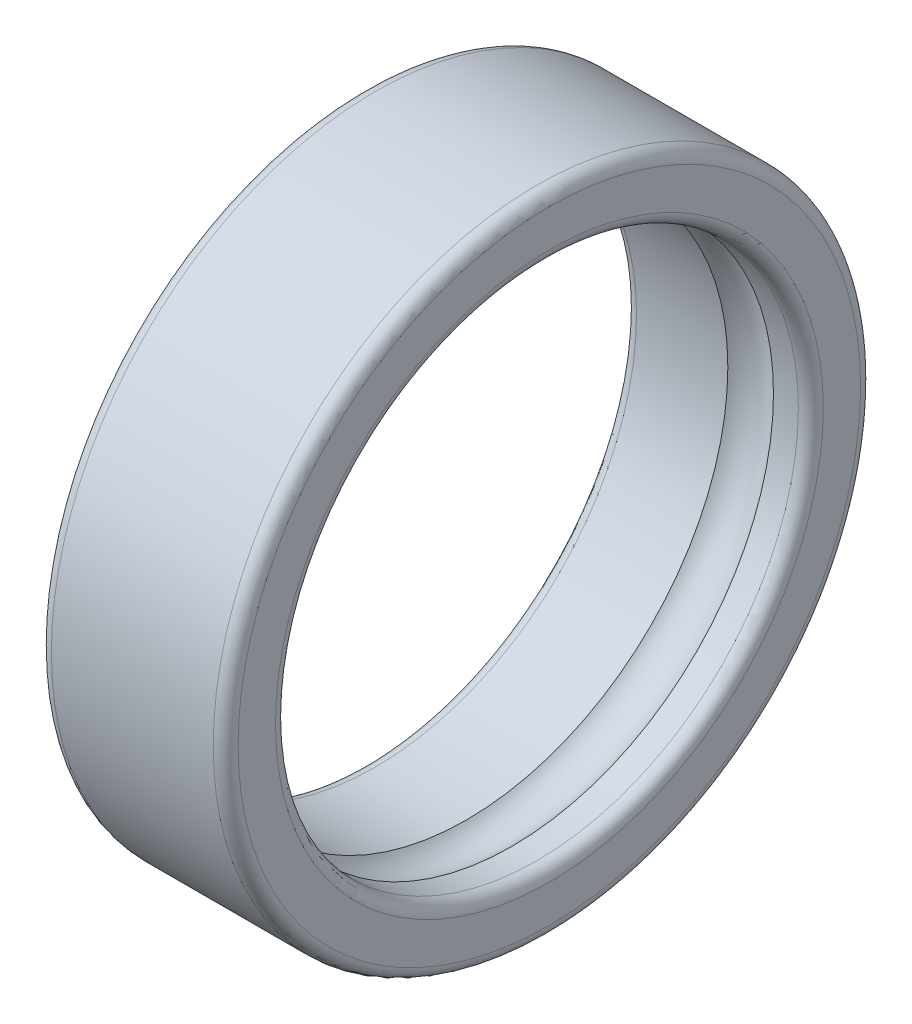
from build123d import *


with BuildPart() as part:
    # Sketch1 → Revolve1 (revolve)
    with BuildSketch(Plane.XY, mode=Mode.PRIVATE) as revolve1_sk:
        with BuildLine():
            Line((-7.5, 22), (-7.5, 25))
            ThreePointArc((-7.5, 25), (-7.207106781, 25.707106781), (-6.5, 26))
            Line((-6.5, 26), (6.5, 26))
            ThreePointArc((6.5, 26), (7.207106781, 25.707106781), (7.5, 25))
            Line((7.5, 25), (7.5, 22))
            ThreePointArc((7.5, 22), (7.207106781, 21.292893219), (6.5, 21))
            Line((6.5, 21), (4.5, 21))
            ThreePointArc((4.5, 21), (2.666969722, 21.8), (0.833939444, 21))
            Line((0.833939444, 21), (-6.5, 21))
            ThreePointArc((-6.5, 21), (-7.207106781, 21.292893219), (-7.5, 22))
        make_face()
    revolve(revolve1_sk.sketch.rotate(Axis((16.058340936, 0, 0), (1, 0, 0)), 90), axis=Axis((16.058340936, 0, 0), (1, 0, 0)))


solid = part.part
